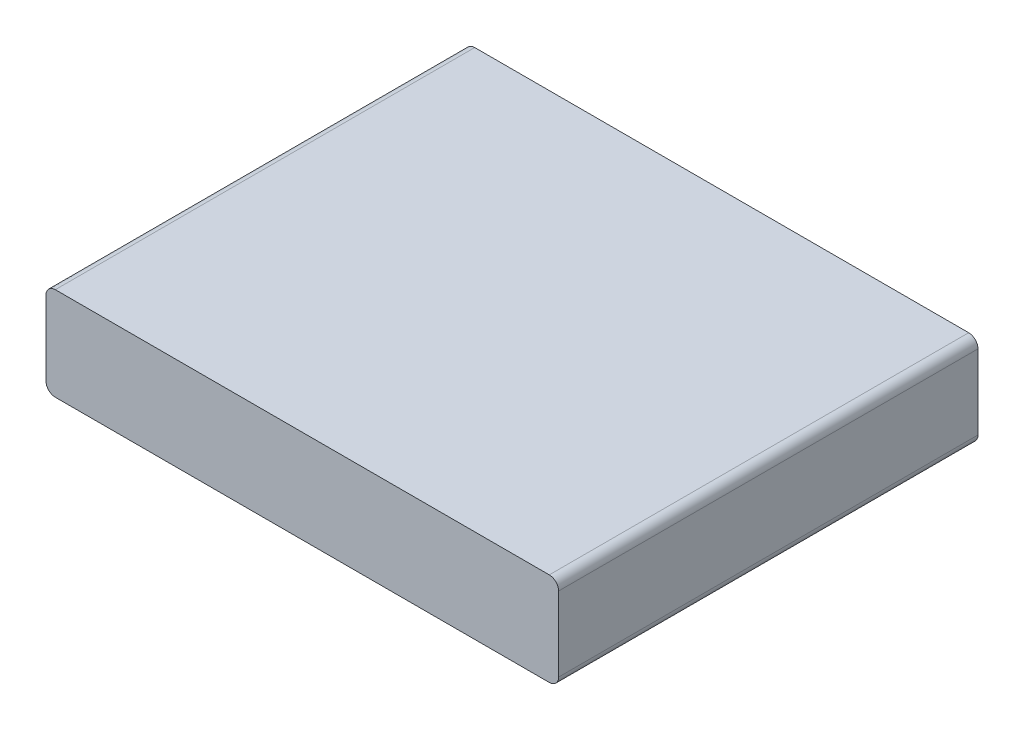
from build123d import *

# Parameters (mm, degrees)
SKETCH2_W           = 550
SKETCH2_H           = 450
BOSS_EXTRUDE1_DEPTH = 100
FILLET2_R           = 10


with BuildPart() as part:
    # Sketch2 → Boss-Extrude1 (new body)
    with BuildSketch(Plane(origin=(0, 0, 0), x_dir=(1, 0, 0), z_dir=(0, 1, 0))):
        with Locations((111.087570621, 17.973163842)):
            Rectangle(SKETCH2_W, SKETCH2_H)
    extrude(amount=BOSS_EXTRUDE1_DEPTH)

    # Fillet2
    fillet2_edges = [part.edges().sort_by_distance(p)[0] for p in [
        (386.087570621, 100, -17.973163842),
        (-163.912429379, 100, -17.973163842),
        (386.087570621, 0, -17.973163842),
        (-163.912429379, 0, -17.973163842),
    ]]
    fillet(fillet2_edges, radius=FILLET2_R)


solid = part.part
